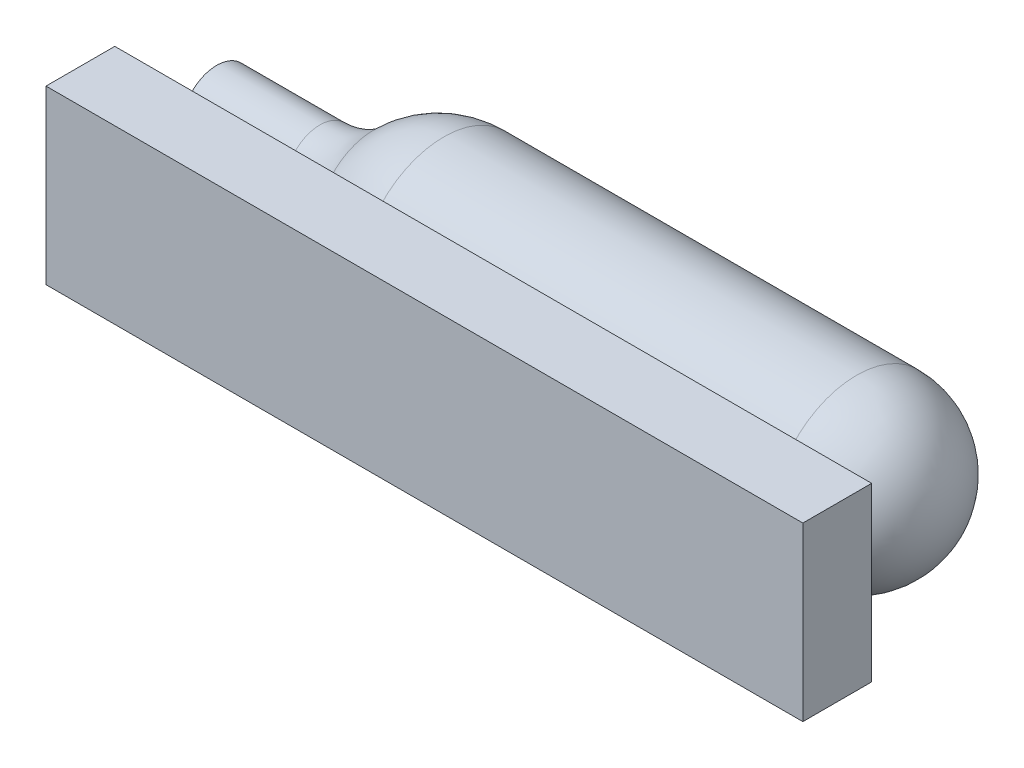
from build123d import *

# Parameters (mm, degrees)
SKETCH2_W           = 279.4
SKETCH2_H           = 63.5
BOSS_EXTRUDE1_DEPTH = 25.4


with BuildPart() as part:
    # Sketch1 → Revolve2 (revolve)
    with BuildSketch(Plane.XY, mode=Mode.PRIVATE) as revolve2_sk:
        with BuildLine():
            Line((-126.226742161, -6.820301867), (-164.326742161, -6.820301867))
            Line((-164.326742161, -6.820301867), (-164.326742161, -19.520301867))
            Line((-164.326742161, -19.520301867), (103.66748842, -19.520301867))
            ThreePointArc((103.66748842, -19.520301867), (94.368128723, 2.930338436), (71.91748842, 12.229698133))
            Line((71.91748842, 12.229698133), (-80.48251158, 12.229698133))
            ThreePointArc((-80.48251158, 12.229698133), (-94.517345864, 9.424103828), (-106.395004854, 1.438545006))
            ThreePointArc((-106.395004854, 1.438545006), (-115.485392661, -4.673082428), (-126.226742161, -6.820301867))
        make_face()
    revolve(revolve2_sk.sketch.rotate(Axis((-164.326742161, -19.520301867, 0), (1, 0, 0)), 90), axis=Axis((-164.326742161, -19.520301867, 0), (1, 0, 0)))


with BuildPart() as body_2:
    # Sketch2 → Boss-Extrude1 (new body)
    with BuildSketch(Plane.XY.offset(31.75)):
        with Locations((-30.48, -19.558)):
            Rectangle(SKETCH2_W, SKETCH2_H)
    extrude(amount=BOSS_EXTRUDE1_DEPTH)


solid = Compound([part.part, body_2.part])
